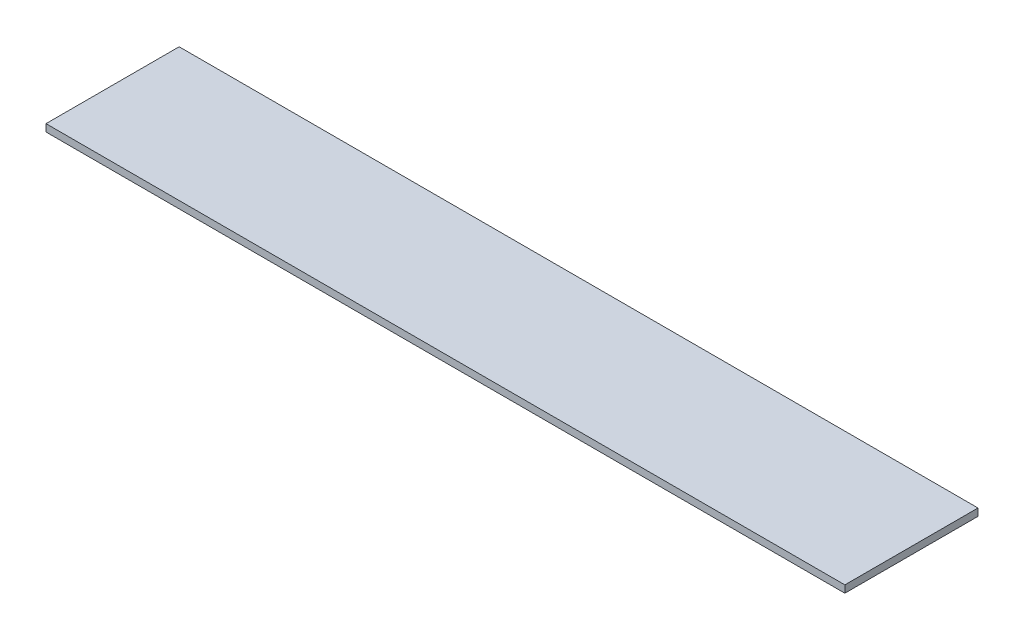
from build123d import *

# Parameters (mm, degrees)
SKETCH1_W           = 838.2
SKETCH1_H           = 139.7
BOSS_EXTRUDE1_DEPTH = 7.62


with BuildPart() as part:
    # Sketch1 → Boss-Extrude1 (new body)
    with BuildSketch(Plane(origin=(0, 0, 0), x_dir=(1, 0, 0), z_dir=(0, 1, 0))):
        with Locations((419.1, 69.85)):
            Rectangle(SKETCH1_W, SKETCH1_H)
    extrude(amount=BOSS_EXTRUDE1_DEPTH)


solid = part.part
